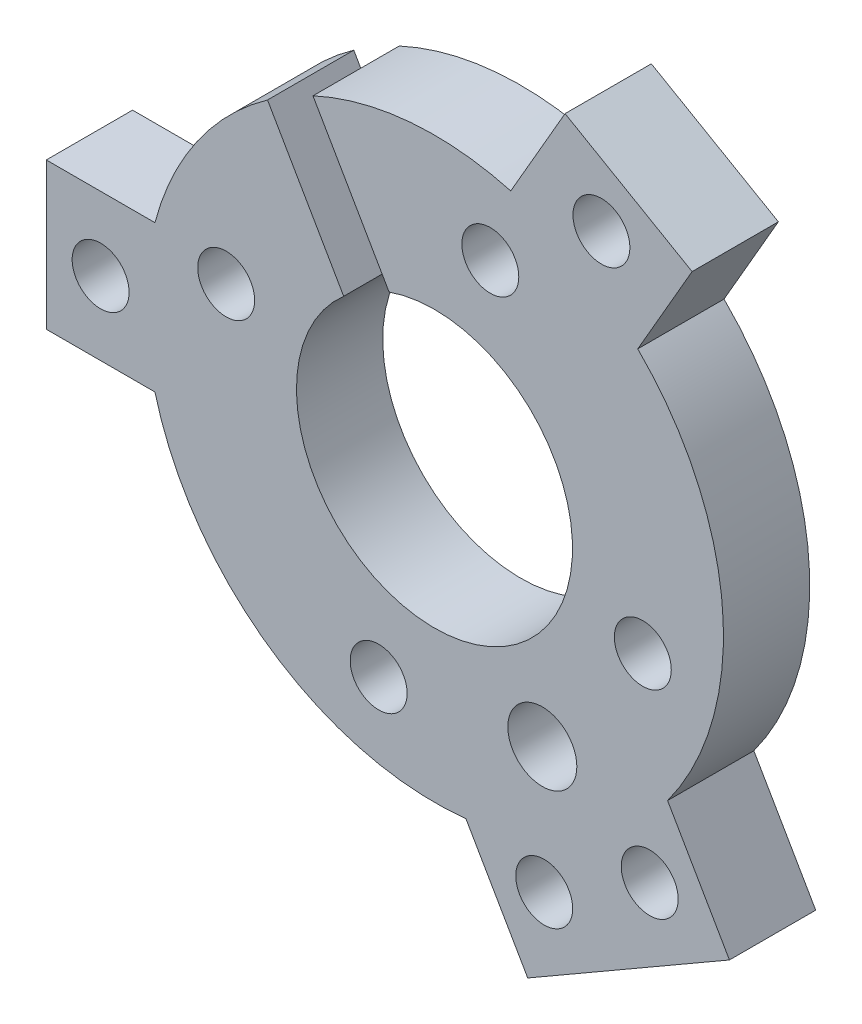
from build123d import *

# Parameters (mm, degrees)
SALIENTE_EXTRUIR3_DEPTH = 10
CROQUIS2_R              = 16
CROQUIS2_R_2            = 4
CROQUIS2_R_3            = 3.3
CORTAR_EXTRUIR1_DEPTH   = 65.926288457


with BuildPart() as part:
    # Croquis1 → Saliente-Extruir3 (new body)
    with BuildSketch(Plane.XY):
        with BuildLine():
            Line((-45, -8.5), (-32.403703492, -8.5))
            ThreePointArc((-32.403703492, -8.5), (-33.5, 0), (-32.403703492, 8.5))
            Line((-32.403703492, 8.5), (-45, 8.5))
            Line((-45, 8.5), (-45, -8.5))
        make_face()
        with BuildLine():
            ThreePointArc((-32.403703492, 8.5), (-33.5, 0), (-32.403703492, -8.5))
            Line((-32.403703492, -8.5), (-30, -8.5))
            Line((-30, -8.5), (-30, 8.5))
            Line((-30, 8.5), (-32.403703492, 8.5))
        make_face()
        with BuildLine():
            Line((3.308657049, -32.730762114), (26.691342951, -19.230762114))
            Line((26.691342951, -19.230762114), (27.021052668, -19.801836095))
            ThreePointArc((27.021052668, -19.801836095), (31.839089688, -10.417406962), (33.5, 0))
            ThreePointArc((33.5, 0), (30.916118508, 12.901302895), (23.563067678, 23.812430401))
            Line((23.563067678, 23.812430401), (22.361215932, 21.730762114))
            Line((22.361215932, 21.730762114), (7.638784068, 30.230762114))
            Line((7.638784068, 30.230762114), (8.840635814, 32.312430401))
            ThreePointArc((8.840635814, 32.312430401), (-16.75, 29.011851027), (-32.403703492, 8.5))
            Line((-32.403703492, 8.5), (-30, 8.5))
            Line((-30, 8.5), (-30, -8.5))
            Line((-30, -8.5), (-32.403703492, -8.5))
            ThreePointArc((-32.403703492, -8.5), (-18.9906271, -27.597211496), (3.638366766, -33.301836095))
            Line((3.638366766, -33.301836095), (3.308657049, -32.730762114))
        make_face()
        with BuildLine():
            Line((22.361215932, 21.730762114), (23.563067678, 23.812430401))
            ThreePointArc((23.563067678, 23.812430401), (16.75, 29.011851027), (8.840635814, 32.312430401))
            Line((8.840635814, 32.312430401), (7.638784068, 30.230762114))
            Line((7.638784068, 30.230762114), (22.361215932, 21.730762114))
        make_face()
        with BuildLine():
            ThreePointArc((8.840635814, 32.312430401), (16.75, 29.011851027), (23.563067678, 23.812430401))
            Line((23.563067678, 23.812430401), (29.861215932, 34.72114317))
            Line((29.861215932, 34.72114317), (15.138784068, 43.22114317))
            Line((15.138784068, 43.22114317), (8.840635814, 32.312430401))
        make_face()
        with BuildLine():
            Line((27.021052668, -19.801836095), (26.691342951, -19.230762114))
            Line((26.691342951, -19.230762114), (3.308657049, -32.730762114))
            Line((3.308657049, -32.730762114), (3.638366766, -33.301836095))
            ThreePointArc((3.638366766, -33.301836095), (16.75, -29.011851027), (27.021052668, -19.801836095))
        make_face()
        with BuildLine():
            Line((34.191342951, -32.22114317), (27.021052668, -19.801836095))
            ThreePointArc((27.021052668, -19.801836095), (16.75, -29.011851027), (3.638366766, -33.301836095))
            Line((3.638366766, -33.301836095), (10.808657049, -45.72114317))
            Line((10.808657049, -45.72114317), (34.191342951, -32.22114317))
        make_face()
    extrude(amount=SALIENTE_EXTRUIR3_DEPTH)

    # Croquis2 → Cortar-Extruir1 (cut, through all)
    with BuildSketch(Plane.XY.offset(10)):
        Circle(CROQUIS2_R)
        with Locations((12.5, -21.650635095)):
            Circle(CROQUIS2_R_2)
        with Locations((24.148145657, -6.470476128)):
            Circle(CROQUIS2_R_3)
        with Locations((-6.470476128, -24.148145657)):
            Circle(CROQUIS2_R_3)
        with Locations((6.470476128, 24.148145657)):
            Circle(CROQUIS2_R_3)
        with Locations((-24.148145657, 6.470476128)):
            Circle(CROQUIS2_R_3)
        with Locations((24.947836968, -29.091113341)):
            Circle(CROQUIS2_R_3)
        with Locations((12.719724694, -36.151017254)):
            Circle(CROQUIS2_R_3)
        Polygon((-19.486906027, 27.568394577), (-10.486906027, 11.979937309), (-5.213138932, 15.024748161), (-14.213138932, 30.613205429), align=None)
        with Locations((-38.701851746, 0)):
            Circle(CROQUIS2_R_3)
        with Locations((19.350925873, 33.516786786)):
            Circle(CROQUIS2_R_3)
    extrude(amount=-CORTAR_EXTRUIR1_DEPTH, mode=Mode.SUBTRACT)


solid = part.part
